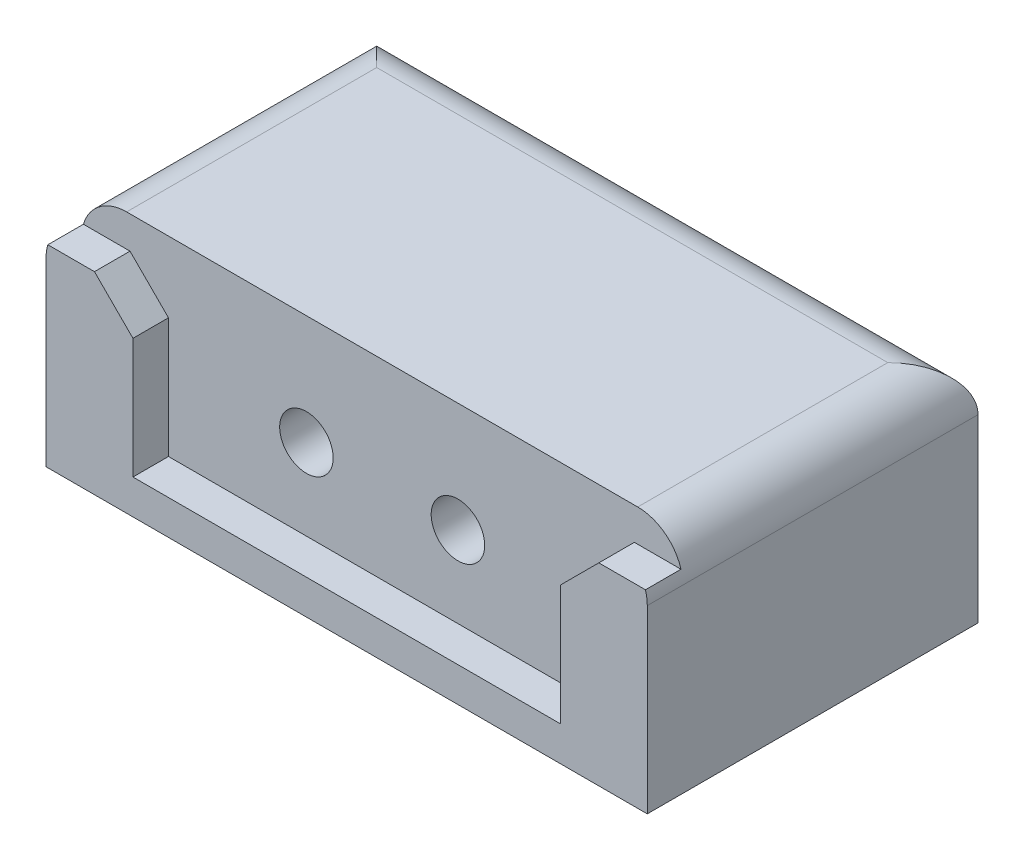
from build123d import *

# Parameters (mm, degrees)
SKETCH1_W             = 25.4
SKETCH1_H             = 9.525
BOSS_EXTRUDE1_DEPTH   = 13.97
CUT_EXTRUDE1_DEPTH    = 1.50114
F_4_40_TAPPED_HOLE1_D = 2.2606
SKETCH5_R             = 2.6543
CUT_EXTRUDE2_DEPTH    = 7.62
FILLET1_R             = 1.905


with BuildPart() as part:
    # Sketch1 → Boss-Extrude1 (new body)
    with BuildSketch(Plane.XY):
        Rectangle(SKETCH1_W, SKETCH1_H)
    extrude(amount=BOSS_EXTRUDE1_DEPTH)

    # Sketch2 → Cut-Extrude1 (cut)
    with BuildSketch(Plane.XY.offset(13.97)):
        Polygon((10.6, 3.525), (12.7, 3.525), (12.7, 4.7625), (-12.7, 4.7625), (-12.681617083, 3.525), (-10.6, 3.525), (-8.9, 1.825), (-8.9, -3.175), (8.9, -3.175), (8.9, 1.825), align=None)
        Polygon((12.7, 3.398), (12.7, 3.525), (10.6, 3.525), (8.9, 1.825), (8.9, -3.175), (-8.9, -3.175), (-8.9, 1.825), (-10.6, 3.525), (-12.681617083, 3.525), (-12.7, 4.7625), (-12.7, 3.398), (-10.652605122, 3.398), (-9.027, 1.772394878), (-9.027, -3.302), (9.027, -3.302), (9.027, 1.772394878), (10.652605122, 3.398), align=None)
    extrude(amount=-CUT_EXTRUDE1_DEPTH, mode=Mode.SUBTRACT)

    # #4-40 Tapped Hole1 (through all)
    with Locations(Plane.XY.offset(12.46886)):
        with Locations((-3.2, 0.125), (3.2, 0.125)):
            Hole(F_4_40_TAPPED_HOLE1_D / 2)

    # Sketch5 → Cut-Extrude2 (cut)
    with BuildSketch(Plane.XZ.offset(4.7625)):
        with Locations(Location((-6.985, 6.985, 0), (0, 0, 270))):
            Circle(SKETCH5_R)
        with Locations(Location((6.985, 6.985, 0), (0, 0, 270))):
            Circle(SKETCH5_R)
    extrude(amount=-CUT_EXTRUDE2_DEPTH, mode=Mode.SUBTRACT)

    # Fillet1
    fillet1_edges = [part.edges().sort_by_distance(p)[0] for p in [
        (-12.7, 4.7625, 6.23443),
        (0, 4.7625, 0),
        (12.7, 4.7625, 6.23443),
    ]]
    fillet(fillet1_edges, radius=FILLET1_R)


solid = part.part
